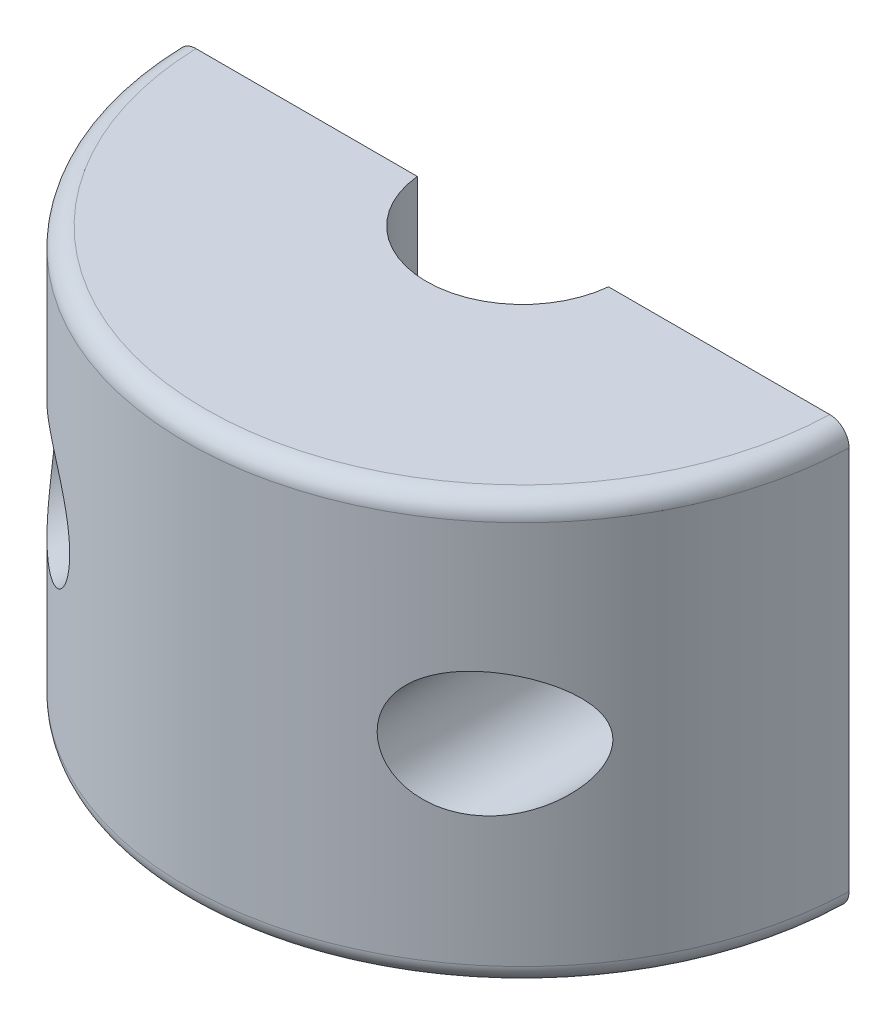
from build123d import *

# Parameters (mm, degrees)
BOSS_EXTRUDE1_DEPTH = 22
SKETCH3_R           = 1.75
CUT_EXTRUDE1_DEPTH  = 22
SKETCH4_R           = 3.25
CUT_EXTRUDE2_DEPTH  = 22
FILLET1_R           = 1
SKETCH5_W           = 36.583479506
SKETCH5_H           = 0.5
CUT_EXTRUDE3_DEPTH  = 39


with BuildPart() as part:
    # Sketch2 → Boss-Extrude1 (new body)
    with BuildSketch(Plane(origin=(0, 0, 0), x_dir=(1, 0, 0), z_dir=(0, 1, 0))):
        with BuildLine():
            Line((5, 0), (17.5, 0))
            ThreePointArc((17.5, 0), (0, -17.5), (-17.5, 0))
            Line((-17.5, 0), (-5, 0))
            ThreePointArc((-5, 0), (0, -5), (5, 0))
        make_face()
    extrude(amount=BOSS_EXTRUDE1_DEPTH)

    # Sketch3 → Cut-Extrude1 (cut)
    with BuildSketch(Plane(origin=(0, 0, 0), x_dir=(-1, 0, 0), z_dir=(0, 0, -1))):
        with Locations((11.25, 11)):
            Circle(SKETCH3_R)
        with Locations((-11.25, 11)):
            Circle(SKETCH3_R)
    extrude(amount=-CUT_EXTRUDE1_DEPTH, mode=Mode.SUBTRACT)

    # Sketch4 → Cut-Extrude2 (cut)
    with BuildSketch(Plane(origin=(0, 0, 4.5), x_dir=(-1, 0, 0), z_dir=(0, 0, -1))):
        with Locations((-11.25, 11)):
            Circle(SKETCH4_R)
        with Locations((11.25, 11)):
            Circle(SKETCH4_R)
    extrude(amount=-CUT_EXTRUDE2_DEPTH, mode=Mode.SUBTRACT)

    # Fillet1
    fillet1_edges = [part.edges().sort_by_distance(p)[0] for p in [
        (0, 22, 17.5),
        (0, 0, 17.5),
    ]]
    fillet(fillet1_edges, radius=FILLET1_R)

    # Sketch5 → Cut-Extrude3 (cut)
    with BuildSketch(Plane(origin=(0, 22, 0), x_dir=(1, 0, 0), z_dir=(0, 1, 0))):
        with Locations((-0.146844137, -0.25)):
            Rectangle(SKETCH5_W, SKETCH5_H)
    extrude(amount=-CUT_EXTRUDE3_DEPTH, mode=Mode.SUBTRACT)


solid = part.part
